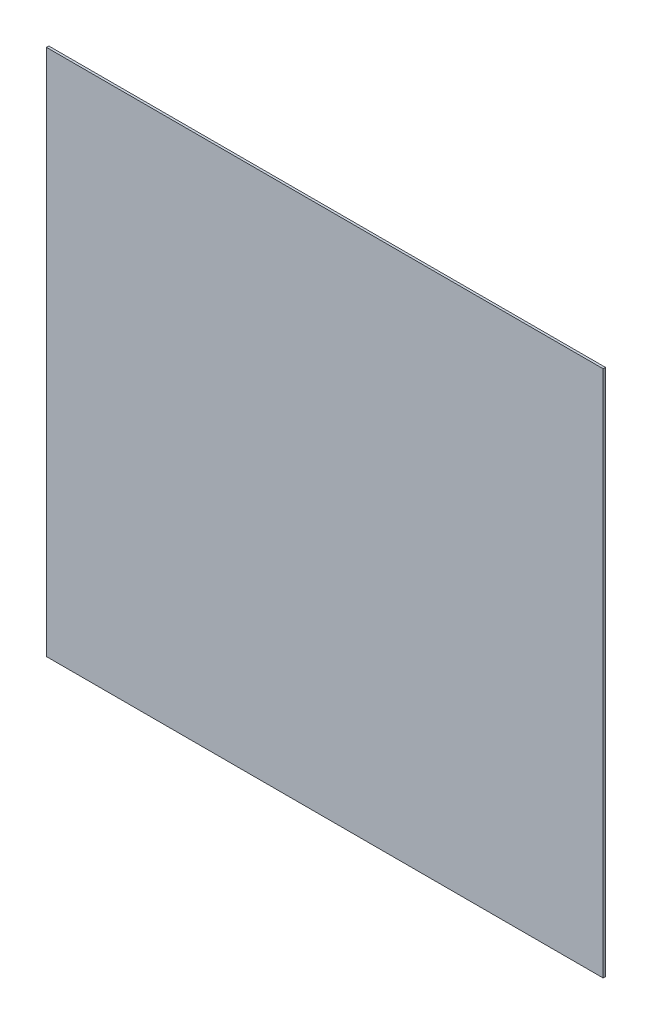
from build123d import *

# Parameters (mm, degrees)
CROQUIS1_W              = 1120.95
CROQUIS1_H              = 1062.525
SALIENTE_EXTRUIR1_DEPTH = 4.7625


with BuildPart() as part:
    # Croquis1 → Saliente-Extruir1 (new body)
    with BuildSketch(Plane.XY):
        Rectangle(CROQUIS1_W, CROQUIS1_H)
    extrude(amount=SALIENTE_EXTRUIR1_DEPTH)


solid = part.part
